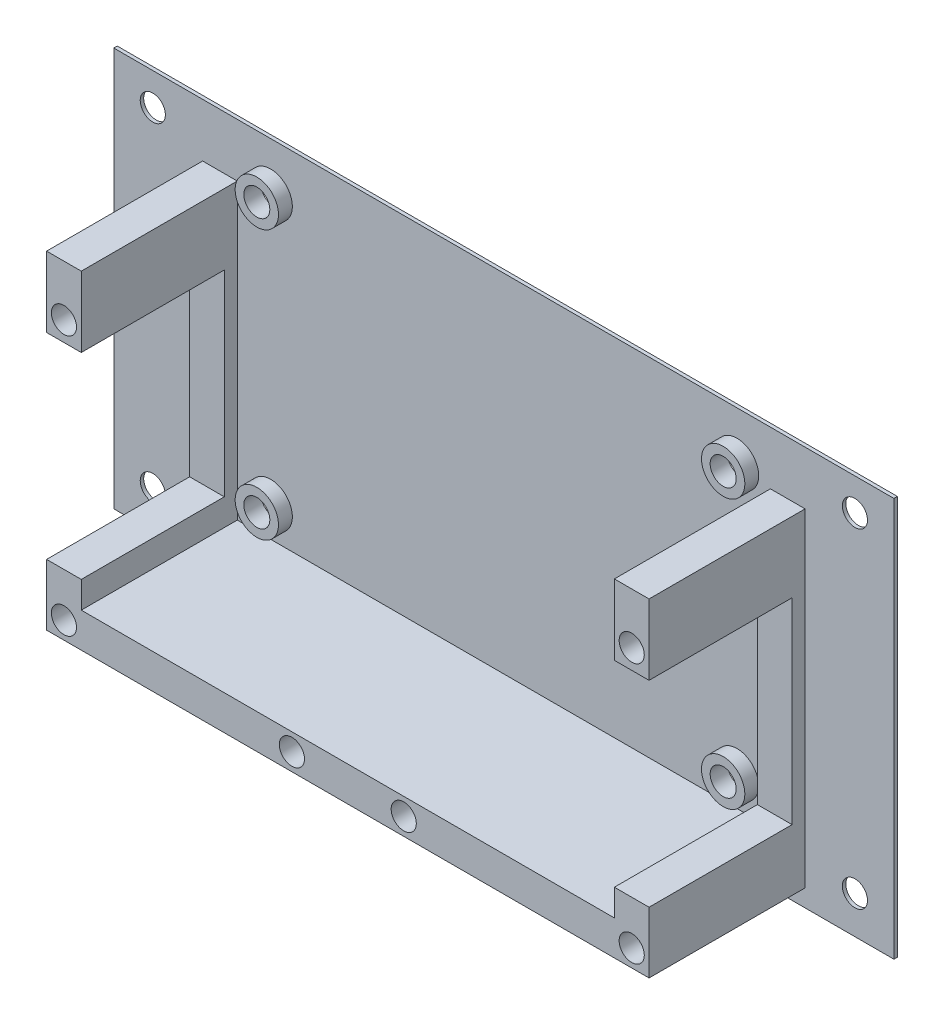
from build123d import *

# Parameters (mm, degrees)
SKIZZE1_W                       = 90
SKIZZE1_H                       = 50
AUFSATZ_LINEAR_AUSTRAGEN1_DEPTH = 0.4
SKIZZE3_R                       = 1.5
SCHNITT_LINEAR_AUSTRAGEN1_DEPTH = 52.479704739
AUFSATZ_LINEAR_START            = 1.6
SKIZZE18_R                      = 2.5
SKIZZE18_R_2                    = 1.5
AUFSATZ_LINEAR_AUSTRAGEN5_DEPTH = 1.6
SKIZZE22_R                      = 1.45
AUFSATZ_LINEAR_AUSTRAGEN7_DEPTH = 18
SKIZZE24_W                      = 4
SKIZZE24_H                      = 22.665276743
AUFSATZ_LINEAR_AUSTRAGEN8_DEPTH = 1.5
SKIZZE25_W                      = 0.4
SKIZZE25_H                      = 3.961895835
SCHNITT_LINEAR_AUSTRAGEN4_DEPTH = 96.202731053
SKIZZE26_R                      = 1.45
SCHNITT_LINEAR_AUSTRAGEN5_DEPTH = 1


with BuildPart() as part:
    # Skizze1 → Aufsatz-Linear austragen1 (new body)
    with BuildSketch(Plane.XY):
        Rectangle(SKIZZE1_W, SKIZZE1_H)
    extrude(amount=AUFSATZ_LINEAR_AUSTRAGEN1_DEPTH)

    # Skizze3 → Schnitt-Linear austragen1 (cut, through all)
    with BuildSketch(Plane.XY.offset(0.4)):
        with Locations((-26.9, 19.461895835)):
            Circle(SKIZZE3_R)
        with Locations((26.9, 19.461895835)):
            Circle(SKIZZE3_R)
        with Locations((26.9, -11.538104165)):
            Circle(SKIZZE3_R)
        with Locations((-26.9, -11.538104165)):
            Circle(SKIZZE3_R)
    extrude(amount=-SCHNITT_LINEAR_AUSTRAGEN1_DEPTH, mode=Mode.SUBTRACT)

    # Skizze18 → Aufsatz-Linear austragen5 (add)
    # profile 1 of 4: a face of its own
    with BuildSketch(Plane.XY.offset(0.4).offset(AUFSATZ_LINEAR_START)):
        with Locations(Location((-26.9, 19.461895835, 0), (0, 0, 180))):
            Circle(SKIZZE18_R)
        with Locations((-26.9, 19.461895835)):
            Circle(SKIZZE18_R_2, mode=Mode.SUBTRACT)
    # profile 2 of 4: a face of its own
    with BuildSketch(Plane.XY.offset(0.4).offset(AUFSATZ_LINEAR_START)):
        with Locations(Location((26.9, 19.461895835, 0), (0, 0, 180))):
            Circle(SKIZZE18_R)
        with Locations((26.9, 19.461895835)):
            Circle(SKIZZE18_R_2, mode=Mode.SUBTRACT)
    # profile 3 of 4: a face of its own
    with BuildSketch(Plane.XY.offset(0.4).offset(AUFSATZ_LINEAR_START)):
        with Locations(Location((26.9, -11.538104165, 0), (0, 0, 180))):
            Circle(SKIZZE18_R)
        with Locations((26.9, -11.538104165)):
            Circle(SKIZZE18_R_2, mode=Mode.SUBTRACT)
    # profile 4 of 4: a face of its own
    with BuildSketch(Plane.XY.offset(0.4).offset(AUFSATZ_LINEAR_START)):
        with Locations(Location((-26.9, -11.538104165, 0), (0, 0, 180))):
            Circle(SKIZZE18_R)
        with Locations((-26.9, -11.538104165)):
            Circle(SKIZZE18_R_2, mode=Mode.SUBTRACT)
    extrude(amount=-AUFSATZ_LINEAR_AUSTRAGEN5_DEPTH)

    # Skizze22 → Aufsatz-Linear austragen7 (add)
    # profile 1 of 3: a face of its own
    with BuildSketch(Plane.XY.offset(0.4)):
        Polygon((30.75, -15.038104165), (0, -15.038104165), (-30.75, -15.038104165), (-30.75, -11.965150571), (-34.75, -11.965150571), (-34.75, -19.038104165), (0, -19.038104165), (34.75, -19.038104165), (34.75, -11.965150571), (30.75, -11.965150571), align=None)
        with Locations((32.75, -17.038104165)):
            Circle(SKIZZE22_R, mode=Mode.SUBTRACT)
        with Locations((6.45, -17.038104165)):
            Circle(SKIZZE22_R, mode=Mode.SUBTRACT)
        with Locations(Location((-6.45, -17.038104165, 0), (0, 0, 180))):
            Circle(SKIZZE22_R, mode=Mode.SUBTRACT)
        with Locations(Location((-32.75, -17.038104165, 0), (0, 0, 180))):
            Circle(SKIZZE22_R, mode=Mode.SUBTRACT)
    # profile 2 of 3: a face of its own
    with BuildSketch(Plane.XY.offset(0.4)):
        Polygon((34.75, 15.223665498), (34.75, 18.83332796), (30.75, 18.83332796), (30.75, 15.223665498), (30.75, 10.700126172), (34.75, 10.700126172), align=None)
        with Locations((32.75, 12.961895835)):
            Circle(SKIZZE22_R, mode=Mode.SUBTRACT)
    # profile 3 of 3: a face of its own
    with BuildSketch(Plane.XY.offset(0.4)):
        Polygon((-30.75, 18.83332796), (-30.75, 15.223665498), (-30.75, 10.700126172), (-34.75, 10.700126172), (-34.75, 15.223665498), (-34.75, 18.83332796), align=None)
        with Locations(Location((-32.75, 12.961895835, 0), (0, 0, 180))):
            Circle(SKIZZE22_R, mode=Mode.SUBTRACT)
    extrude(amount=AUFSATZ_LINEAR_AUSTRAGEN7_DEPTH)

    # Skizze24 → Aufsatz-Linear austragen8 (add)
    with BuildSketch(Plane.XY.offset(0.4)):
        with Locations((-32.75, -0.632512199)):
            Rectangle(SKIZZE24_W, SKIZZE24_H)
        with Locations((32.75, -0.632512199)):
            Rectangle(SKIZZE24_W, SKIZZE24_H)
    extrude(amount=AUFSATZ_LINEAR_AUSTRAGEN8_DEPTH)

    # Skizze25 → Schnitt-Linear austragen4 (cut, through all)
    with BuildSketch(Plane(origin=(45, 0, 0), x_dir=(0, 0, -1), z_dir=(1, 0, 0))):
        with Locations((-0.2, -23.019052083)):
            Rectangle(SKIZZE25_W, SKIZZE25_H)
    extrude(amount=-SCHNITT_LINEAR_AUSTRAGEN4_DEPTH, mode=Mode.SUBTRACT)

    # Skizze26 → Schnitt-Linear austragen5 (cut)
    with BuildSketch(Plane(origin=(0, 0, 0), x_dir=(-1, 0, 0), z_dir=(0, 0, -1))):
        with Locations((-40.5, -16.7)):
            Circle(SKIZZE26_R)
        with Locations((-40.5, 21.3)):
            Circle(SKIZZE26_R)
        with Locations((40.5, -16.7)):
            Circle(SKIZZE26_R)
        with Locations((40.5, 21.3)):
            Circle(SKIZZE26_R)
    extrude(amount=-SCHNITT_LINEAR_AUSTRAGEN5_DEPTH, mode=Mode.SUBTRACT)


solid = part.part
